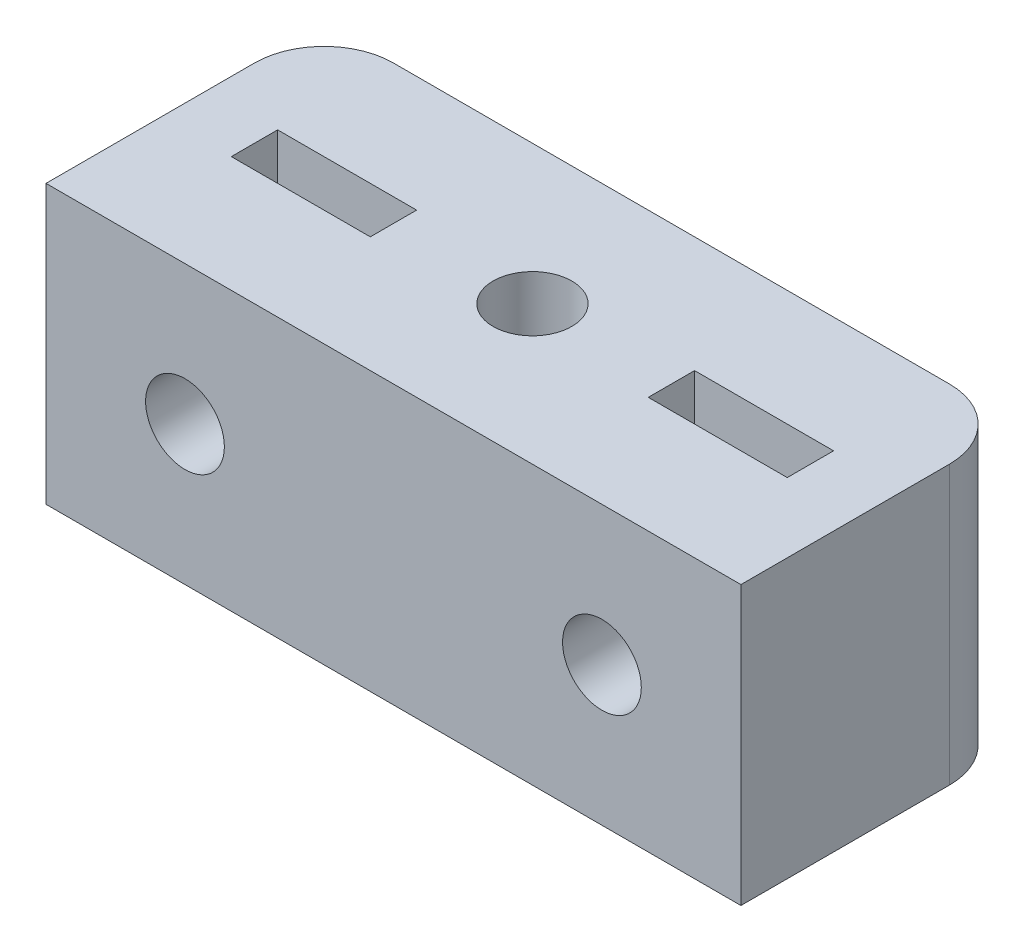
from build123d import *

# Parameters (mm, degrees)
SKETCH1_W           = 30
SKETCH1_H           = 12
BOSS_EXTRUDE1_DEPTH = 6
SKETCH2_R           = 1.7
CUT_EXTRUDE1_DEPTH  = 21.124611797
CUT_EXTRUDE2_DEPTH  = 1
SKETCH4_R           = 1.7
CUT_EXTRUDE3_DEPTH  = 21.124611797
CUT_EXTRUDE4_DEPTH  = 1
FILLET1_R           = 3


with BuildPart() as part:
    # Sketch1 → Boss-Extrude1 (new, symmetric)
    with BuildSketch(Plane(origin=(0, 0, 0), x_dir=(1, 0, 0), z_dir=(0, 1, 0))):
        Rectangle(SKETCH1_W, SKETCH1_H)
    extrude(amount=BOSS_EXTRUDE1_DEPTH, both=True)

    # Sketch2 → Cut-Extrude1 (cut, through all)
    with BuildSketch(Plane.XY.offset(6)):
        with Locations((-9, 0)):
            Circle(SKETCH2_R)
    cut_extrude1 = extrude(amount=-CUT_EXTRUDE1_DEPTH, mode=Mode.SUBTRACT)

    # Sketch3 → Cut-Extrude2 (cut, symmetric)
    with BuildSketch(Plane.XY):
        Polygon((-12, 3), (-12, 6), (-6, 6), (-6, 3), (-6, -3), (-12, -3), align=None)
    cut_extrude2 = extrude(amount=CUT_EXTRUDE2_DEPTH, both=True, mode=Mode.SUBTRACT)

    # Mirror1: Cut-Extrude1, Cut-Extrude2 across plane
    add(cut_extrude1.mirror(Plane(origin=(0, 0, 0), x_dir=(0, 0, 1), z_dir=(1, 0, 0))), mode=Mode.SUBTRACT)
    add(cut_extrude2.mirror(Plane(origin=(0, 0, 0), x_dir=(0, 0, 1), z_dir=(1, 0, 0))), mode=Mode.SUBTRACT)

    # Sketch4 → Cut-Extrude3 (cut, through all)
    with BuildSketch(Plane(origin=(0, 6, 0), x_dir=(1, 0, 0), z_dir=(0, 1, 0))):
        with Locations(Location((0, 0, 0), (0, 0, 270))):
            Circle(SKETCH4_R)
    extrude(amount=-CUT_EXTRUDE3_DEPTH, mode=Mode.SUBTRACT)

    # Sketch5 → Cut-Extrude4 (cut, symmetric)
    with BuildSketch(Plane(origin=(0, 0, 0), x_dir=(1, 0, 0), z_dir=(0, 1, 0))):
        Polygon((-3, 3), (-3, 6), (3, 6), (3, 3), (3, -3), (-3, -3), align=None)
    extrude(amount=CUT_EXTRUDE4_DEPTH, both=True, mode=Mode.SUBTRACT)

    # Fillet1
    fillet1_edges = [part.edges().sort_by_distance(p)[0] for p in [
        (-15, 0, -6),
        (15, 0, -6),
    ]]
    fillet(fillet1_edges, radius=FILLET1_R)


solid = part.part
